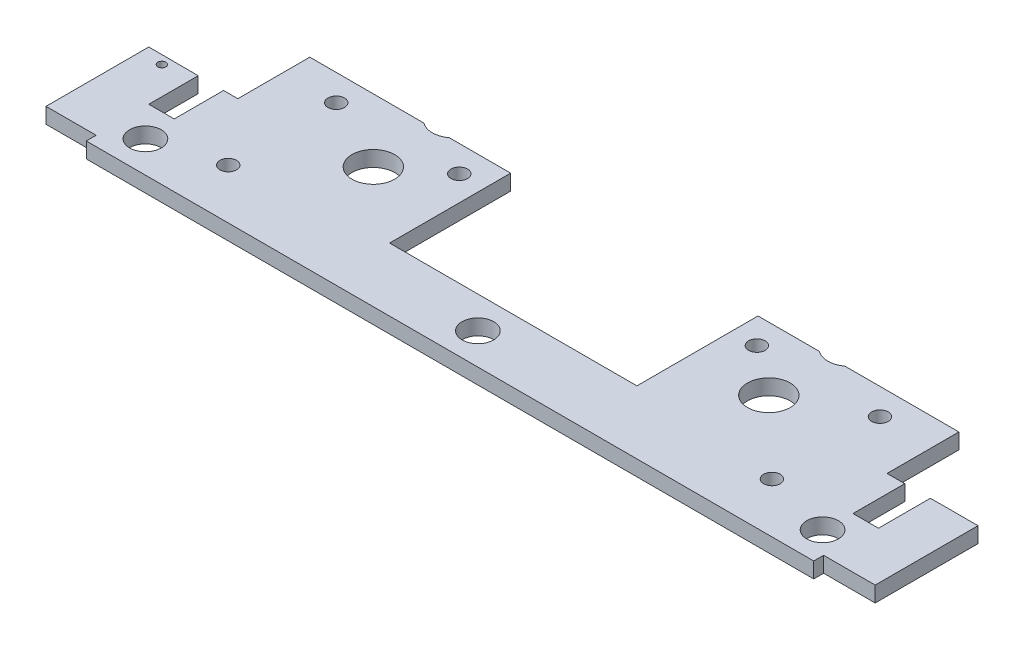
from build123d import *

# Parameters (mm, degrees)
SKETCH1_R                           = 2.159
BOSS_EXTRUDE1_DEPTH                 = 1.575
SKETCH2_W                           = 93.457658642
SKETCH2_H                           = 6.602
CUT_EXTRUDE1_DEPTH                  = 65.362755899
CUT_EXTRUDE2_DEPTH                  = 60.755092082
CUT_EXTRUDE3_DEPTH                  = 60.755092082
SKETCH6_R                           = 0.8382
CUT_EXTRUDE4_DEPTH                  = 2.54
SKETCH7_W                           = 65.648
SKETCH7_H                           = 12
CUT_EXTRUDE5_DEPTH                  = 59.286069146
SKETCH11_R                          = 0.412551942
ID_HOLE_DEPTH                       = 59.286069146
SKETCH12_W                          = 2.575
SKETCH12_H                          = 5
NOTCH_FOR_BPR_TOP_VIEW_DEPTH        = 59.286069146
SKETCH14_W                          = 2.575
SKETCH14_H                          = 12.502619879
NOTCH_FOR_BPL_TOP_VIEW_DEPTH        = 59.286069146
SKETCH17_W                          = 73.57
SKETCH17_H                          = 1
CREATE_LIP_FOR_M3_SPACER_HOLE_DEPTH = 1.575
SKETCH15_R                          = 1.6
HOLE_FOR_M3_SPACER_DEPTH            = 59.977069112


with BuildPart() as part:
    # Sketch1 → Boss-Extrude1 (new body)
    with BuildSketch(Plane(origin=(0, 0, 0), x_dir=(1, 0, 0), z_dir=(0, 1, 0))):
        Polygon((44.351293299, -40.014412246), (37.136293299, -40.014412246), (37.136293299, -46.615946892), (29.968293307, -46.615946892), (-30.083706693, -46.615946892), (-36.433706701, -46.615946892), (-36.433706701, -40.014412246), (-43.648706701, -40.014412246), (-43.648706701, -30.885946892), (-43.648706701, -29.647946892), (-42.378706693, -29.615946892), (-32.472706701, -29.647946892), (-32.472706701, -10.370428445), (-12.155556701, -10.370428445), (-12.155556701, -34.615947016), (-11.557706701, -34.615947016), (12.260293299, -34.615947016), (12.858143299, -34.615947016), (12.858143299, -10.370428445), (33.175293299, -10.370428445), (33.175293299, -12.929386892), (33.175293299, -29.647946892), (38.746293307, -29.615946892), (42.351293307, -29.615946892), (44.351293299, -29.615946892), (44.351293299, -31.651946892), align=None)
        with Locations(Location((-19.648556701, -28.76738335, 0), (0, 0, 270))):
            Circle(SKETCH1_R, mode=Mode.SUBTRACT)
        with Locations(Location((-19.648556701, -20.63938335, 0), (0, 0, 270))):
            Circle(SKETCH1_R, mode=Mode.SUBTRACT)
        with Locations(Location((20.351397299, -20.63938335, 0), (0, 0, 270))):
            Circle(SKETCH1_R, mode=Mode.SUBTRACT)
        with Locations(Location((20.351397299, -28.76738335, 0), (0, 0, 270))):
            Circle(SKETCH1_R, mode=Mode.SUBTRACT)
    extrude(amount=BOSS_EXTRUDE1_DEPTH)

    # Sketch2 → Cut-Extrude1 (cut, through all)
    with BuildSketch(Plane.XZ):
        with Locations((-2.377536022, 43.315412246)):
            Rectangle(SKETCH2_W, SKETCH2_H)
    extrude(amount=-CUT_EXTRUDE1_DEPTH, mode=Mode.SUBTRACT)

    # Sketch3 → Cut-Extrude2 (cut, through all)
    with BuildSketch(Plane.XZ):
        Polygon((-41.504650493, 40.014412246), (-41.504650493, 29.618770413), (-34.629650483, 29.640979175), (-34.629650483, 8.976090323), (-48.128778183, 8.976090323), (-48.128778183, 40.014412246), align=None)
    extrude(amount=-CUT_EXTRUDE2_DEPTH, mode=Mode.SUBTRACT)

    # Sketch4 → Cut-Extrude3 (cut, through all)
    with BuildSketch(Plane.XZ):
        Polygon((42.351293299, 40.014412246), (42.351293299, 32.420104455), (42.351293299, 29.615946892), (35.476293307, 29.615946892), (35.476293307, 10.370428445), (54.710892309, 10.370428445), (54.710892309, 40.014412246), align=None)
    extrude(amount=-CUT_EXTRUDE3_DEPTH, mode=Mode.SUBTRACT)

    # Sketch6 → Cut-Extrude4 (cut)
    with BuildSketch(Plane(origin=(0, 0, 0), x_dir=(-1, 0, 0), z_dir=(0, -1, 0))):
        with Locations(Location((27.141556701, -35.947946892, 0), (0, 0, 90))):
            Circle(SKETCH6_R)
        with Locations(Location((27.141556701, -25.025946892, 0), (0, 0, 90))):
            Circle(SKETCH6_R)
        with Locations(Location((14.695556701, -25.025946892, 0), (0, 0, 90))):
            Circle(SKETCH6_R)
        with Locations(Location((-15.398143299, -25.025946892, 0), (0, 0, 90))):
            Circle(SKETCH6_R)
        with Locations(Location((-27.844397299, -25.025946892, 0), (0, 0, 90))):
            Circle(SKETCH6_R)
        with Locations(Location((-27.844397299, -35.947946892, 0), (0, 0, 90))):
            Circle(SKETCH6_R)
    extrude(amount=-CUT_EXTRUDE4_DEPTH, mode=Mode.SUBTRACT)

    # Sketch7 → Cut-Extrude5 (cut, through all)
    with BuildSketch(Plane.XZ):
        with Locations((0.351293299, 16.370428445)):
            Rectangle(SKETCH7_W, SKETCH7_H)
    extrude(amount=-CUT_EXTRUDE5_DEPTH, mode=Mode.SUBTRACT)

    # Sketch11 → ID HOLE (cut, through all)
    with BuildSketch(Plane(origin=(0, 1.575, 0), x_dir=(1, 0, 0), z_dir=(0, 1, 0))):
        with Locations(Location((-39.304798754, -30.495020326, 0), (0, 0, 270))):
            Circle(SKETCH11_R)
    extrude(amount=-ID_HOLE_DEPTH, mode=Mode.SUBTRACT)

    # Sketch12 → Notch for BPR (TOP VIEW) (cut, through all)
    with BuildSketch(Plane(origin=(0, 0, 0), x_dir=(-1, 0, 0), z_dir=(0, -1, 0))):
        with Locations((35.201150493, -32.134973926)):
            Rectangle(SKETCH12_W, SKETCH12_H)
    extrude(amount=-NOTCH_FOR_BPR_TOP_VIEW_DEPTH, mode=Mode.SUBTRACT)

    # Sketch14 → Notch for BPL (TOP VIEW) (cut, through all)
    with BuildSketch(Plane(origin=(0, 0, 0), x_dir=(-1, 0, 0), z_dir=(0, -1, 0))):
        with Locations((-36.253849507, -28.621738385)):
            Rectangle(SKETCH14_W, SKETCH14_H)
    extrude(amount=-NOTCH_FOR_BPL_TOP_VIEW_DEPTH, mode=Mode.SUBTRACT)

    # Sketch17 → Create Lip for M3 Spacer Hole (add)
    with BuildSketch(Plane.XZ):
        with Locations((0.351293299, 40.514412246)):
            Rectangle(SKETCH17_W, SKETCH17_H)
    extrude(amount=-CREATE_LIP_FOR_M3_SPACER_HOLE_DEPTH)

    # Sketch15 → HOLE for M3 Spacer (cut, through all)
    with BuildSketch(Plane.XZ):
        with Locations(Location((-0.006565304, 37.835831124, 0), (0, 0, 270))):
            Circle(SKETCH15_R)
        with Locations(Location((-33.628715371, 37.835831124, 0), (0, 0, 270))):
            Circle(SKETCH15_R)
        with Locations(Location((34.851293299, 37.835831124, 0), (0, 0, 270))):
            Circle(SKETCH15_R)
    extrude(amount=-HOLE_FOR_M3_SPACER_DEPTH, mode=Mode.SUBTRACT)


solid = part.part
